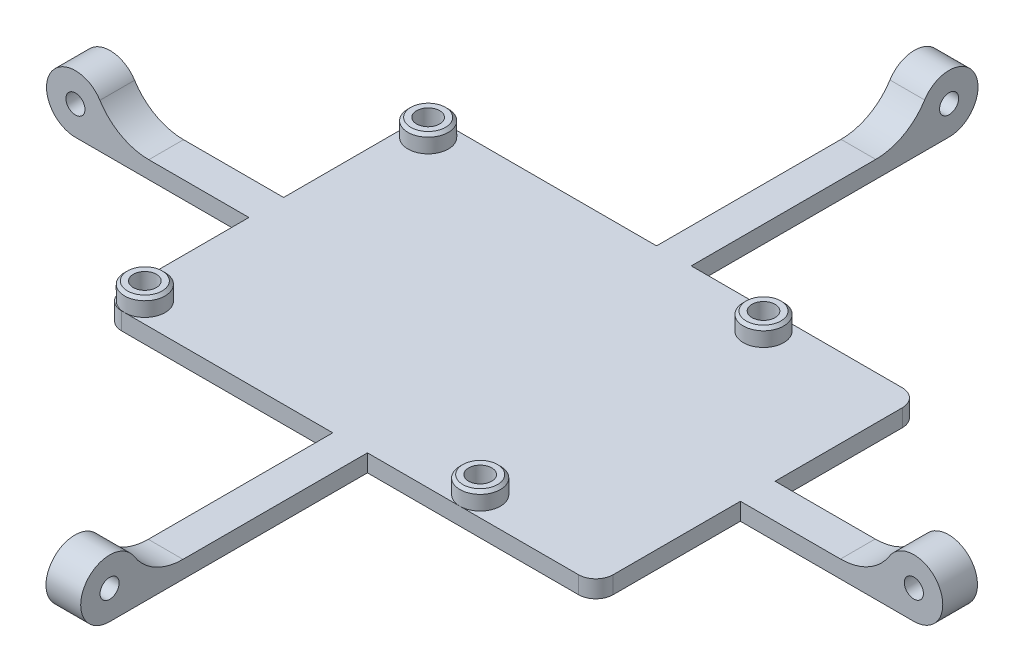
from build123d import *

# Parameters (mm, degrees)
SKETCH1_R                = 2
BOSS_EXTRUDE1_DEPTH      = 3
BOSS_EXTRUDE3_DEPTH      = 3
SKETCH2_R                = 3.5
SKETCH2_R_2              = 2
BOSS_EXTRUDE2_DEPTH      = 3
SKETCH4_R                = 5
SKETCH4_R_2              = 1.65
BOSS_EXTRUDE4_DEPTH      = 6
FILLET1_R                = 10
SKETCH6_R                = 5
SKETCH6_R_2              = 1.65
BOSS_EXTRUDE5_DEPTH      = 6
FILLET2_R                = 10
CIRPATTERN4_COUNT        = 2
FILLET1_OF_CIRPATTERN4_R = 10
FILLET2_OF_MIRROR1_R     = 10
CHAMFER1_SIZE            = 0.5


with BuildPart() as part:
    # Sketch1 → Boss-Extrude1 (new body)
    with BuildSketch(Plane(origin=(0, 0, 0), x_dir=(1, 0, 0), z_dir=(0, 1, 0))):
        with BuildLine():
            Line((-39.5, -28), (39.5, -28))
            ThreePointArc((39.5, -28), (41.621320344, -27.121320344), (42.5, -25))
            Line((42.5, -25), (42.5, 25))
            ThreePointArc((42.5, 25), (41.621320344, 27.121320344), (39.5, 28))
            Line((39.5, 28), (-39.5, 28))
            ThreePointArc((-39.5, 28), (-41.621320344, 27.121320344), (-42.5, 25))
            Line((-42.5, 25), (-42.5, -25))
            ThreePointArc((-42.5, -25), (-41.621320344, -27.121320344), (-39.5, -28))
        make_face()
        with Locations(Location((-39, -24.5, 0), (0, 0, 270))):
            Circle(SKETCH1_R, mode=Mode.SUBTRACT)
        with Locations(Location((-39, 24.5, 0), (0, 0, 270))):
            Circle(SKETCH1_R, mode=Mode.SUBTRACT)
        with Locations(Location((19, 24.5, 0), (0, 0, 270))):
            Circle(SKETCH1_R, mode=Mode.SUBTRACT)
        with Locations(Location((19, -24.5, 0), (0, 0, 270))):
            Circle(SKETCH1_R, mode=Mode.SUBTRACT)
    extrude(amount=BOSS_EXTRUDE1_DEPTH)

    # Sketch3 → Boss-Extrude3 (add)
    with BuildSketch(Plane(origin=(0, 3, 0), x_dir=(1, 0, 0), z_dir=(0, 1, 0))):
        Polygon((-3, 3), (-72.5, 3), (-72.5, -3), (-3, -3), (-3, -72.5), (3, -72.5), (3, -3), (72.5, -3), (72.5, 3), (3, 3), (3, 72.5), (-3, 72.5), align=None)
    boss_extrude3 = extrude(amount=-BOSS_EXTRUDE3_DEPTH)

    # Sketch2 → Boss-Extrude2 (add)
    # profile 1 of 4: a face of its own
    with BuildSketch(Plane(origin=(0, 3, 0), x_dir=(1, 0, 0), z_dir=(0, 1, 0))):
        with Locations(Location((-39, -24.5, 0), (0, 0, 270))):
            Circle(SKETCH2_R)
        with Locations(Location((-39, -24.5, 0), (0, 0, 270))):
            Circle(SKETCH2_R_2, mode=Mode.SUBTRACT)
    # profile 2 of 4: a face of its own
    with BuildSketch(Plane(origin=(0, 3, 0), x_dir=(1, 0, 0), z_dir=(0, 1, 0))):
        with Locations(Location((-39, 24.5, 0), (0, 0, 90))):
            Circle(SKETCH2_R)
        with Locations(Location((-39, 24.5, 0), (0, 0, 270))):
            Circle(SKETCH2_R_2, mode=Mode.SUBTRACT)
    # profile 3 of 4: a face of its own
    with BuildSketch(Plane(origin=(0, 3, 0), x_dir=(1, 0, 0), z_dir=(0, 1, 0))):
        with Locations(Location((19, 24.5, 0), (0, 0, 90))):
            Circle(SKETCH2_R)
        with Locations(Location((19, 24.5, 0), (0, 0, 270))):
            Circle(SKETCH2_R_2, mode=Mode.SUBTRACT)
    # profile 4 of 4: a face of its own
    with BuildSketch(Plane(origin=(0, 3, 0), x_dir=(1, 0, 0), z_dir=(0, 1, 0))):
        with Locations(Location((19, -24.5, 0), (0, 0, 270))):
            Circle(SKETCH2_R)
        with Locations(Location((19, -24.5, 0), (0, 0, 270))):
            Circle(SKETCH2_R_2, mode=Mode.SUBTRACT)
    extrude(amount=BOSS_EXTRUDE2_DEPTH)

    # Sketch4 → Boss-Extrude4 (add)
    with BuildSketch(Plane.XY.offset(3)):
        with Locations((-72.5, 5)):
            Circle(SKETCH4_R)
        with Locations((-72.5, 5)):
            Circle(SKETCH4_R_2, mode=Mode.SUBTRACT)
    boss_extrude4 = extrude(amount=-BOSS_EXTRUDE4_DEPTH)

    # Fillet1
    fillet1_edges = [part.edges().sort_by_distance(p)[0] for p in [
        (-67.917424305, 3, 0),
    ]]
    fillet(fillet1_edges, radius=FILLET1_R)

    # Sketch6 → Boss-Extrude5 (add)
    with BuildSketch(Plane(origin=(3, 0, 0), x_dir=(0, 0, -1), z_dir=(1, 0, 0))):
        with Locations((-72.592807544, 4.999138602)):
            Circle(SKETCH6_R)
        with Locations((-72.592807544, 4.999138602)):
            Circle(SKETCH6_R_2, mode=Mode.SUBTRACT)
    boss_extrude5 = extrude(amount=-BOSS_EXTRUDE5_DEPTH)

    # Fillet2
    fillet2_edges = [part.edges().sort_by_distance(p)[0] for p in [
        (0, 3, 68.009856001),
    ]]
    fillet(fillet2_edges, radius=FILLET2_R)

    # CirPattern4: Boss-Extrude3, Boss-Extrude4 ×2 about axis
    cirpattern4_axis = Axis((0, 0, 0), (0, 1, 0))
    add([boss_extrude3.rotate(cirpattern4_axis, i * 360 / CIRPATTERN4_COUNT) for i in range(1, CIRPATTERN4_COUNT)])
    add([boss_extrude4.rotate(cirpattern4_axis, i * 360 / CIRPATTERN4_COUNT) for i in range(1, CIRPATTERN4_COUNT)])

    # Fillet1 of CirPattern4
    fillet1_of_cirpattern4_edges = [part.edges().sort_by_distance(p)[0] for p in [
        (67.917424305, 3, 0),
    ]]
    fillet(fillet1_of_cirpattern4_edges, radius=FILLET1_OF_CIRPATTERN4_R)

    # Mirror1: Boss-Extrude5 across plane
    add(boss_extrude5.mirror(Plane.XY))

    # Fillet2 of Mirror1
    fillet2_of_mirror1_edges = [part.edges().sort_by_distance(p)[0] for p in [
        (0, 3, -68.009856001),
    ]]
    fillet(fillet2_of_mirror1_edges, radius=FILLET2_OF_MIRROR1_R)

    # Chamfer1
    chamfer1_edges = [part.edges().sort_by_distance(p)[0] for p in [
        (-39, 6, 21),
        (-39, 6, -21),
        (19, 6, -21),
        (19, 6, 21),
    ]]
    chamfer(chamfer1_edges, length=CHAMFER1_SIZE)


solid = part.part
